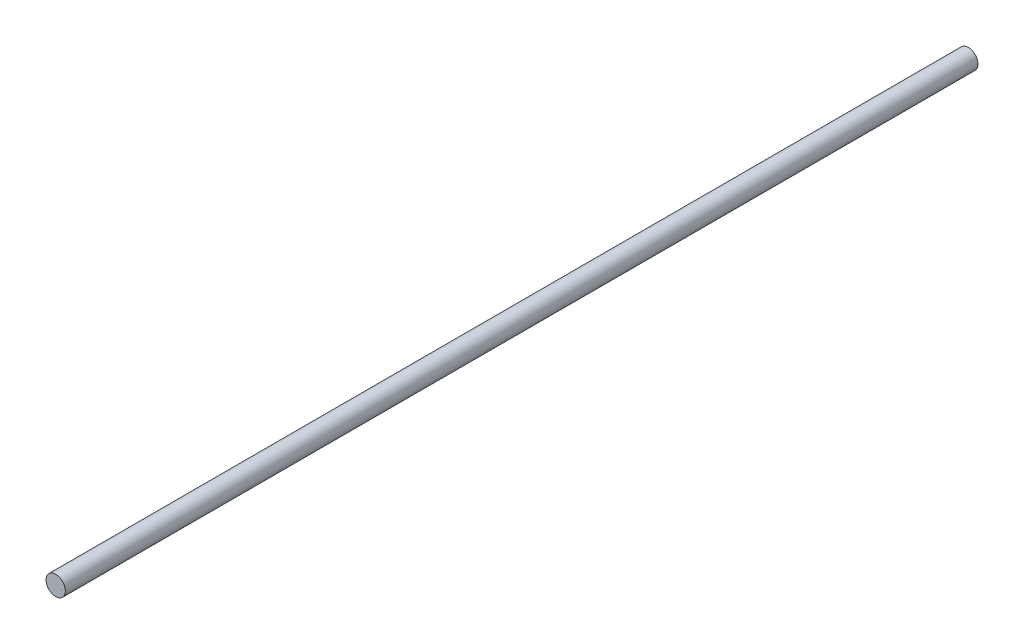
from build123d import *

# Parameters (mm, degrees)
SKETCH_1_R      = 6
EXTRUDE_1_DEPTH = 282.5


with BuildPart() as part:
    # Эскиз1 → Бобышка-Вытянуть1 (new, symmetric)
    with BuildSketch(Plane.XY):
        Circle(SKETCH_1_R)
    extrude(amount=EXTRUDE_1_DEPTH, both=True)


solid = part.part
